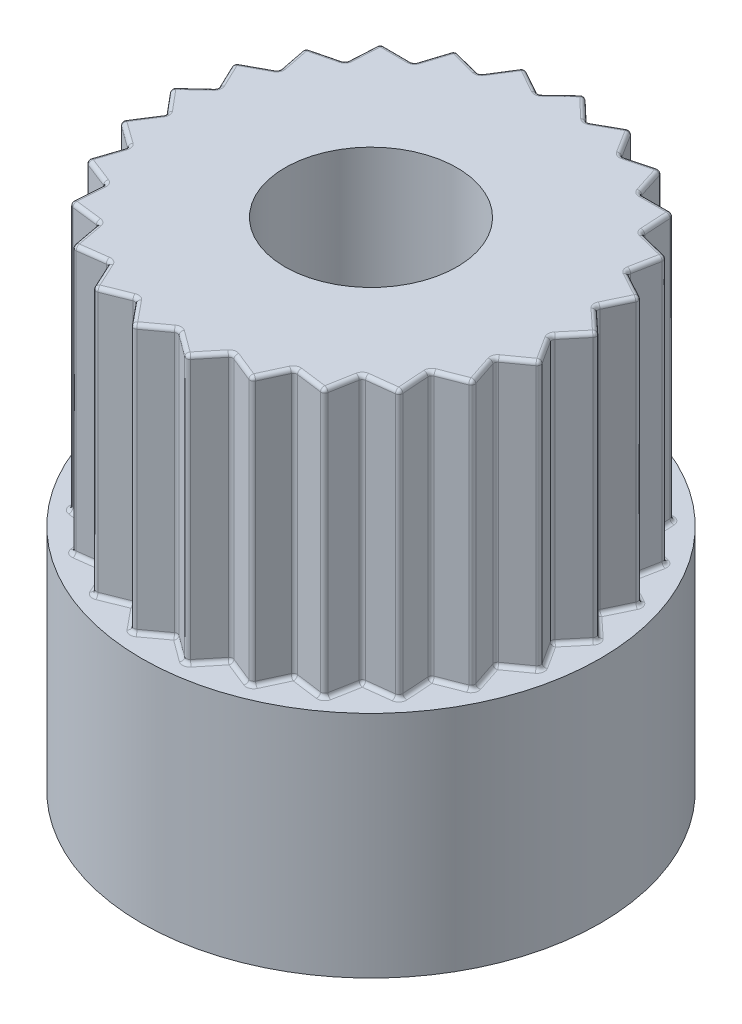
from build123d import *

# Parameters (mm, degrees)
SKETCH1_R           = 3
BOSS_EXTRUDE1_DEPTH = 3
SKETCH2_R           = 2.8
BOSS_EXTRUDE2_DEPTH = 3.5
SKETCH3_R           = 3.664567481
CUT_EXTRUDE2_DEPTH  = 3.5
SKETCH4_R           = 1.125
CUT_EXTRUDE3_DEPTH  = 5.5
FILLET2_R           = 0.05


with BuildPart() as part:
    # Sketch1 → Boss-Extrude1 (new body)
    with BuildSketch(Plane(origin=(0, 0, 0), x_dir=(1, 0, 0), z_dir=(0, 1, 0))):
        with Locations(Location((0, 0, 0), (0, 0, 270))):
            Circle(SKETCH1_R)
    extrude(amount=BOSS_EXTRUDE1_DEPTH)

    # Sketch2 → Boss-Extrude2 (add)
    with BuildSketch(Plane(origin=(0, 3, 0), x_dir=(1, 0, 0), z_dir=(0, 1, 0))):
        with Locations(Location((0, 0, 0), (0, 0, 270))):
            Circle(SKETCH2_R)
    extrude(amount=BOSS_EXTRUDE2_DEPTH)

    # Sketch3 → Cut-Extrude2 (cut)
    with BuildSketch(Plane(origin=(0, 6.5, 0), x_dir=(1, 0, 0), z_dir=(0, 1, 0))):
        Circle(SKETCH3_R)
        Polygon((0, 2.8), (-0.315823446, 2.5), (-0.696331684, 2.712032851), (-0.92762599, 2.342915806), (-1.348910287, 2.453658704), (-1.481142381, 2.038617595), (-1.916731897, 2.041112157), (-1.941593149, 1.606225543), (-2.364118191, 1.500315026), (-2.280046479, 1.072908432), (-2.662958246, 0.865247584), (-2.475236103, 0.47217654), (-2.79447484, 0.175813455), (-2.514897539, -0.158223942), (-2.750404302, -0.524667681), (-2.396538714, -0.778682631), (-2.533515747, -1.192182016), (-2.127596548, -1.350213827), (-2.15743708, -1.784787171), (-1.724969666, -1.836906122), (-1.645798706, -2.265247584), (-1.213956596, -2.20817885), (-1.030748748, -2.60337416), (-0.626666168, -2.44070358), (-0.350933054, -2.777921164), (0, -2.519869927), (0.350933054, -2.777921164), (0.626666168, -2.44070358), (1.030748748, -2.60337416), (1.213956596, -2.20817885), (1.645798706, -2.265247584), (1.724969666, -1.836906122), (2.15743708, -1.784787171), (2.127596548, -1.350213827), (2.533515747, -1.192182016), (2.396538714, -0.778682631), (2.750404302, -0.524667681), (2.514897539, -0.158223942), (2.79447484, 0.175813455), (2.475236103, 0.47217654), (2.662958246, 0.865247584), (2.280046479, 1.072908432), (2.364118191, 1.500315026), (1.941593149, 1.606225543), (1.916731897, 2.041112157), (1.481142381, 2.038617595), (1.348910287, 2.453658704), (0.92762599, 2.342915806), (0.696331684, 2.712032851), (0.315823446, 2.5), align=None, mode=Mode.SUBTRACT)
    extrude(amount=-CUT_EXTRUDE2_DEPTH, mode=Mode.SUBTRACT)

    # Sketch4 → Cut-Extrude3 (cut)
    with BuildSketch(Plane(origin=(0, 6.5, 0), x_dir=(1, 0, 0), z_dir=(0, 1, 0))):
        with Locations(Location((0, 0, 0), (0, 0, 270))):
            Circle(SKETCH4_R)
    extrude(amount=-CUT_EXTRUDE3_DEPTH, mode=Mode.SUBTRACT)

    # Fillet2
    fillet2_edges = [part.edges().sort_by_distance(p)[0] for p in [
        (0.488799611, 3, 2.609312372),
        (0.828707458, 3, 2.52203887),
        (1.122352672, 3, 2.405776505),
        (1.429877651, 3, 2.236713217),
        (1.685384186, 3, 2.051076853),
        (1.941203373, 3, 1.810846647),
        (2.142516814, 3, 1.567500499),
        (2.330556147, 3, 1.271197922),
        (2.465027231, 3, 0.985432324),
        (2.573471508, 3, 0.651675156),
        (2.632650921, 3, 0.341445811),
        (2.654686189, 3, -0.008794756),
        (2.634855471, 3, -0.323994997),
        (2.569097174, 3, -0.668712062),
        (2.471502362, 3, -0.969078008),
        (2.322082335, 3, -1.286611729),
        (2.15285567, 3, -1.553270284),
        (1.929162523, 3, -1.82366885),
        (1.698937139, 3, -2.039864876),
        (1.415026334, 3, -2.246138149),
        (1.138268139, 3, -2.398287255),
        (0.811978837, 3, -2.527474328),
        (0.506077565, 3, -2.606016426),
        (0.157911723, 3, -2.65),
        (-0.157911723, 3, -2.65),
        (-0.506077565, 3, -2.606016426),
        (-0.811978837, 3, -2.527474328),
        (-1.138268139, 3, -2.398287255),
        (-1.415026334, 3, -2.246138149),
        (-1.698937139, 3, -2.039864876),
        (-1.929162523, 3, -1.82366885),
        (-2.15285567, 3, -1.553270284),
        (-2.322082335, 3, -1.286611729),
        (-2.471502362, 3, -0.969078008),
        (-2.569097174, 3, -0.668712062),
        (-2.634855471, 3, -0.323994997),
        (-2.654686189, 3, -0.008794756),
        (-2.632650921, 3, 0.341445811),
        (-2.573471508, 3, 0.651675156),
        (-2.465027231, 3, 0.985432324),
        (-2.330556147, 3, 1.271197922),
        (-2.142516814, 3, 1.567500499),
        (-1.941203373, 3, 1.810846647),
        (-1.685384186, 3, 2.051076853),
        (-1.429877651, 3, 2.236713217),
        (-1.122352672, 3, 2.405776505),
        (-0.828707458, 3, 2.52203887),
        (-0.488799611, 3, 2.609312372),
        (-0.175466527, 3, 2.648895545),
        (0.175466527, 3, 2.648895545),
        (0.157911723, 6.5, -2.65),
        (0.315823446, 4.75, -2.5),
        (0.506077565, 6.5, -2.606016426),
        (0.696331684, 4.75, -2.712032851),
        (0.811978837, 6.5, -2.527474328),
        (0.92762599, 4.75, -2.342915806),
        (1.138268139, 6.5, -2.398287255),
        (1.348910287, 4.75, -2.453658704),
        (1.415026334, 6.5, -2.246138149),
        (1.481142381, 4.75, -2.038617595),
        (1.698937139, 6.5, -2.039864876),
        (1.916731897, 4.75, -2.041112157),
        (1.929162523, 6.5, -1.82366885),
        (1.941593149, 4.75, -1.606225543),
        (2.15285567, 6.5, -1.553270284),
        (2.364118191, 4.75, -1.500315026),
        (2.322082335, 6.5, -1.286611729),
        (2.280046479, 4.75, -1.072908432),
        (2.471502362, 6.5, -0.969078008),
        (2.662958246, 4.75, -0.865247584),
        (2.569097174, 6.5, -0.668712062),
        (2.475236103, 4.75, -0.47217654),
        (2.634855471, 6.5, -0.323994997),
        (2.79447484, 4.75, -0.175813455),
        (2.654686189, 6.5, -0.008794756),
        (2.514897539, 4.75, 0.158223942),
        (2.632650921, 6.5, 0.341445811),
        (2.750404302, 4.75, 0.524667681),
        (2.573471508, 6.5, 0.651675156),
        (2.396538714, 4.75, 0.778682631),
        (2.465027231, 6.5, 0.985432324),
        (2.533515747, 4.75, 1.192182016),
        (2.330556147, 6.5, 1.271197922),
        (2.127596548, 4.75, 1.350213827),
        (2.142516814, 6.5, 1.567500499),
        (2.15743708, 4.75, 1.784787171),
        (1.941203373, 6.5, 1.810846647),
        (1.724969666, 4.75, 1.836906122),
        (1.685384186, 6.5, 2.051076853),
        (1.645798706, 4.75, 2.265247584),
        (1.429877651, 6.5, 2.236713217),
        (1.213956596, 4.75, 2.20817885),
        (1.122352672, 6.5, 2.405776505),
        (1.030748748, 4.75, 2.60337416),
        (0.828707458, 6.5, 2.52203887),
        (0.626666168, 4.75, 2.44070358),
        (0.488799611, 6.5, 2.609312372),
        (0.350933054, 4.75, 2.777921164),
        (0.175466527, 6.5, 2.648895545),
        (0, 4.75, 2.519869927),
        (-0.175466527, 6.5, 2.648895545),
        (-0.350933054, 4.75, 2.777921164),
        (-0.488799611, 6.5, 2.609312372),
        (-0.626666168, 4.75, 2.44070358),
        (-0.828707458, 6.5, 2.52203887),
        (-1.030748748, 4.75, 2.60337416),
        (-1.122352672, 6.5, 2.405776505),
        (-1.213956596, 4.75, 2.20817885),
        (-1.429877651, 6.5, 2.236713217),
        (-1.645798706, 4.75, 2.265247584),
        (-1.685384186, 6.5, 2.051076853),
        (-1.724969666, 4.75, 1.836906122),
        (-1.941203373, 6.5, 1.810846647),
        (-2.15743708, 4.75, 1.784787171),
        (-2.142516814, 6.5, 1.567500499),
        (-2.127596548, 4.75, 1.350213827),
        (-2.330556147, 6.5, 1.271197922),
        (-2.533515747, 4.75, 1.192182016),
        (-2.465027231, 6.5, 0.985432324),
        (-2.396538714, 4.75, 0.778682631),
        (-2.573471508, 6.5, 0.651675156),
        (-2.750404302, 4.75, 0.524667681),
        (-2.632650921, 6.5, 0.341445811),
        (-2.514897539, 4.75, 0.158223942),
        (-2.654686189, 6.5, -0.008794756),
        (-2.79447484, 4.75, -0.175813455),
        (-2.634855471, 6.5, -0.323994997),
        (-2.475236103, 4.75, -0.47217654),
        (-2.569097174, 6.5, -0.668712062),
        (-2.662958246, 4.75, -0.865247584),
        (-2.471502362, 6.5, -0.969078008),
        (-2.280046479, 4.75, -1.072908432),
        (-2.322082335, 6.5, -1.286611729),
        (-2.364118191, 4.75, -1.500315026),
        (-2.15285567, 6.5, -1.553270284),
        (-1.941593149, 4.75, -1.606225543),
        (-1.929162523, 6.5, -1.82366885),
        (-1.916731897, 4.75, -2.041112157),
        (-1.698937139, 6.5, -2.039864876),
        (-1.481142381, 4.75, -2.038617595),
        (-1.415026334, 6.5, -2.246138149),
        (-1.348910287, 4.75, -2.453658704),
        (-1.138268139, 6.5, -2.398287255),
        (-0.92762599, 4.75, -2.342915806),
        (-0.811978837, 6.5, -2.527474328),
        (-0.696331684, 4.75, -2.712032851),
        (-0.506077565, 6.5, -2.606016426),
        (-0.315823446, 4.75, -2.5),
        (-0.157911723, 6.5, -2.65),
        (0, 4.75, -2.8),
    ]]
    fillet(fillet2_edges, radius=FILLET2_R)


solid = part.part
